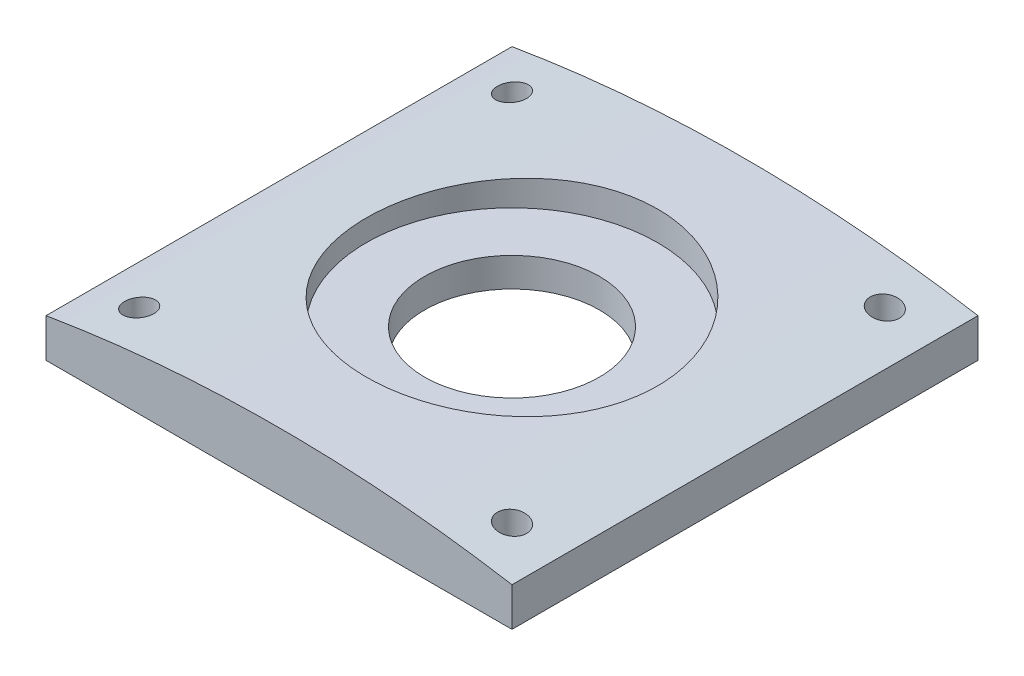
from build123d import *
from build123d.topology import SkipClean

# Parameters (mm, degrees)
SKETCH1_3_W             = 80
SKETCH1_3_H             = 80
SKETCH1_3_R             = 2.5
SKETCH1_3_R_2           = 15
BOSS_EXTRUDE3_DEPTH     = 5
BOSS_EXTRUDE4_START     = 5
SKETCH1_W               = 80
SKETCH1_H               = 80
SKETCH1_R               = 2.5
SKETCH1_R_2             = 25
BOSS_EXTRUDE4_DEPTH     = 5
CUT_EXTRUDE2_DEPTH      = 57.789083458
CUT_EXTRUDE2_DEPTH_BACK = 57.789083458
CUT_EXTRUDE3_DEPTH      = 57.789083608
CUT_EXTRUDE3_DEPTH_BACK = 57.789083608


with BuildPart() as part:
    # Sketch1<3> → Boss-Extrude3 (new body)
    with BuildSketch(Plane(origin=(0, 0, 0), x_dir=(1, 0, 0), z_dir=(0, 1, 0))):
        Rectangle(SKETCH1_3_W, SKETCH1_3_H)
        with Locations((-32, -32)):
            Circle(SKETCH1_3_R, mode=Mode.SUBTRACT)
        with Locations((32, -32)):
            Circle(SKETCH1_3_R, mode=Mode.SUBTRACT)
        with Locations((-32, 32)):
            Circle(SKETCH1_3_R, mode=Mode.SUBTRACT)
        with Locations((32, 32)):
            Circle(SKETCH1_3_R, mode=Mode.SUBTRACT)
        Circle(SKETCH1_3_R_2, mode=Mode.SUBTRACT)
    extrude(amount=-BOSS_EXTRUDE3_DEPTH)

    # Sketch1 → Boss-Extrude4 (add)
    with BuildSketch(Plane(origin=(0, 0, 0), x_dir=(1, 0, 0), z_dir=(0, 1, 0)).offset(BOSS_EXTRUDE4_START)):
        Rectangle(SKETCH1_W, SKETCH1_H)
        with Locations((-32, -32)):
            Circle(SKETCH1_R, mode=Mode.SUBTRACT)
        with Locations((32, -32)):
            Circle(SKETCH1_R, mode=Mode.SUBTRACT)
        Circle(SKETCH1_R_2, mode=Mode.SUBTRACT)
        with Locations((-32, 32)):
            Circle(SKETCH1_R, mode=Mode.SUBTRACT)
        with Locations((32, 32)):
            Circle(SKETCH1_R, mode=Mode.SUBTRACT)
    extrude(amount=-BOSS_EXTRUDE4_DEPTH)

    # Sketch3 → Cut-Extrude2 (cut, two sides: drawn at the far end of the back side and taken through both)
    with BuildSketch(Plane.XY.offset(-CUT_EXTRUDE2_DEPTH_BACK)):
        with BuildLine():
            Line((-40, 1.643191324), (-40, 5))
            Line((-40, 5), (0, 5))
            ThreePointArc((0, 5), (-20.070302467, 4.159325469), (-40, 1.643191324))
        make_face()
    extrude(amount=CUT_EXTRUDE2_DEPTH + CUT_EXTRUDE2_DEPTH_BACK, mode=Mode.SUBTRACT)

    # Sketch3<4> → Cut-Extrude3 (cut, two sides: drawn at the far end of the back side and taken through both)
    with SkipClean():  # the faces are left unmerged after this step: merging them gives an invalid solid
        with BuildSketch(Plane.XY.offset(-CUT_EXTRUDE3_DEPTH_BACK)):
            with BuildLine():
                Line((40, 5), (40, 1.643191324))
                ThreePointArc((40, 1.643191324), (20.070302467, 4.159325469), (0, 5))
                Line((0, 5), (40, 5))
            make_face()
        extrude(amount=CUT_EXTRUDE3_DEPTH + CUT_EXTRUDE3_DEPTH_BACK, mode=Mode.SUBTRACT)


solid = part.part
